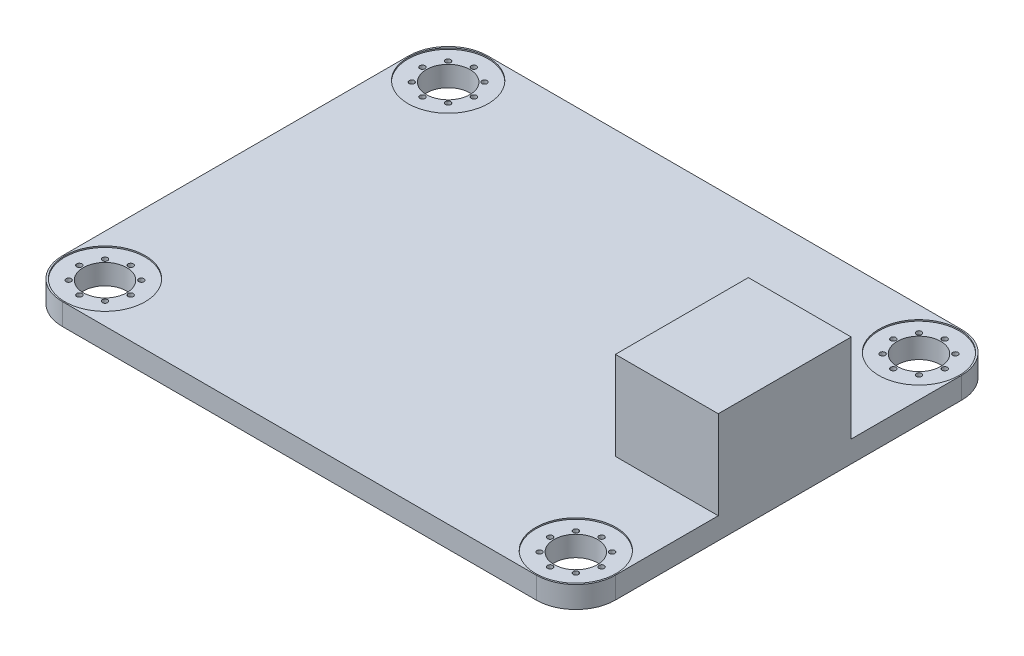
from build123d import *

# Parameters (mm, degrees)
CROQUIS1_W              = 41.94
CROQUIS1_H              = 32.26
CROQUIS1_R              = 1.65
CROQUIS1_R_2            = 0.2
SALIENTE_EXTRUIR1_DEPTH = 1.64
CORTAR_EXTRUIR1_START   = -0.1
CROQUIS2_R              = 3.04
CROQUIS2_R_2            = 1.65
CORTAR_EXTRUIR1_DEPTH   = 0.1
REDONDEO2_R             = 3
CROQUIS3_W              = 7.8
CROQUIS3_H              = 10.08
SALIENTE_EXTRUIR2_DEPTH = 6.7


with BuildPart() as part:
    # Croquis1 → Saliente-Extruir1 (new body)
    with BuildSketch(Plane(origin=(0, 0, 0), x_dir=(1, 0, 0), z_dir=(0, 1, 0))):
        Rectangle(CROQUIS1_W, CROQUIS1_H)
        with Locations(Location((-17.85, 13.01, 0), (0, 0, 270))):
            Circle(CROQUIS1_R, mode=Mode.SUBTRACT)
        with Locations(Location((17.85, 13.01, 0), (0, 0, 90))):
            Circle(CROQUIS1_R, mode=Mode.SUBTRACT)
        with Locations(Location((17.85, -13.01, 0), (0, 0, 270))):
            Circle(CROQUIS1_R, mode=Mode.SUBTRACT)
        with Locations(Location((-17.85, -13.01, 0), (0, 0, 90))):
            Circle(CROQUIS1_R, mode=Mode.SUBTRACT)
        with Locations(Location((-15.9, 13.01, 0), (0, 0, 270))):
            Circle(CROQUIS1_R_2, mode=Mode.SUBTRACT)
        with Locations(Location((-16.471141777, 11.631141777, 0), (0, 0, 270))):
            Circle(CROQUIS1_R_2, mode=Mode.SUBTRACT)
        with Locations(Location((-17.85, 11.06, 0), (0, 0, 270))):
            Circle(CROQUIS1_R_2, mode=Mode.SUBTRACT)
        with Locations(Location((-19.228858223, 11.631141777, 0), (0, 0, 270))):
            Circle(CROQUIS1_R_2, mode=Mode.SUBTRACT)
        with Locations(Location((-19.8, 13.01, 0), (0, 0, 270))):
            Circle(CROQUIS1_R_2, mode=Mode.SUBTRACT)
        with Locations(Location((-19.228858223, 14.388858223, 0), (0, 0, 270))):
            Circle(CROQUIS1_R_2, mode=Mode.SUBTRACT)
        with Locations(Location((-17.85, 14.96, 0), (0, 0, 270))):
            Circle(CROQUIS1_R_2, mode=Mode.SUBTRACT)
        with Locations(Location((-16.471141777, 14.388858223, 0), (0, 0, 270))):
            Circle(CROQUIS1_R_2, mode=Mode.SUBTRACT)
        with Locations(Location((19.8, 13.01, 0), (0, 0, 90))):
            Circle(CROQUIS1_R_2, mode=Mode.SUBTRACT)
        with Locations(Location((19.228858223, 14.388858223, 0), (0, 0, 90))):
            Circle(CROQUIS1_R_2, mode=Mode.SUBTRACT)
        with Locations(Location((17.85, 14.96, 0), (0, 0, 90))):
            Circle(CROQUIS1_R_2, mode=Mode.SUBTRACT)
        with Locations(Location((16.471141777, 14.388858223, 0), (0, 0, 90))):
            Circle(CROQUIS1_R_2, mode=Mode.SUBTRACT)
        with Locations(Location((15.9, 13.01, 0), (0, 0, 90))):
            Circle(CROQUIS1_R_2, mode=Mode.SUBTRACT)
        with Locations(Location((16.471141777, 11.631141777, 0), (0, 0, 90))):
            Circle(CROQUIS1_R_2, mode=Mode.SUBTRACT)
        with Locations(Location((19.228858223, 11.631141777, 0), (0, 0, 90))):
            Circle(CROQUIS1_R_2, mode=Mode.SUBTRACT)
        with Locations(Location((17.85, 11.06, 0), (0, 0, 90))):
            Circle(CROQUIS1_R_2, mode=Mode.SUBTRACT)
        with Locations(Location((19.228858223, -11.631141777, 0), (0, 0, 270))):
            Circle(CROQUIS1_R_2, mode=Mode.SUBTRACT)
        with Locations(Location((19.8, -13.01, 0), (0, 0, 270))):
            Circle(CROQUIS1_R_2, mode=Mode.SUBTRACT)
        with Locations(Location((19.228858223, -14.388858223, 0), (0, 0, 270))):
            Circle(CROQUIS1_R_2, mode=Mode.SUBTRACT)
        with Locations(Location((17.85, -14.96, 0), (0, 0, 270))):
            Circle(CROQUIS1_R_2, mode=Mode.SUBTRACT)
        with Locations(Location((16.471141777, -14.388858223, 0), (0, 0, 270))):
            Circle(CROQUIS1_R_2, mode=Mode.SUBTRACT)
        with Locations(Location((15.9, -13.01, 0), (0, 0, 270))):
            Circle(CROQUIS1_R_2, mode=Mode.SUBTRACT)
        with Locations(Location((17.85, -11.06, 0), (0, 0, 270))):
            Circle(CROQUIS1_R_2, mode=Mode.SUBTRACT)
        with Locations(Location((16.471141777, -11.631141777, 0), (0, 0, 270))):
            Circle(CROQUIS1_R_2, mode=Mode.SUBTRACT)
        with Locations(Location((-19.228858223, -14.388858223, 0), (0, 0, 90))):
            Circle(CROQUIS1_R_2, mode=Mode.SUBTRACT)
        with Locations(Location((-17.85, -14.96, 0), (0, 0, 90))):
            Circle(CROQUIS1_R_2, mode=Mode.SUBTRACT)
        with Locations(Location((-16.471141777, -14.388858223, 0), (0, 0, 90))):
            Circle(CROQUIS1_R_2, mode=Mode.SUBTRACT)
        with Locations(Location((-15.9, -13.01, 0), (0, 0, 90))):
            Circle(CROQUIS1_R_2, mode=Mode.SUBTRACT)
        with Locations(Location((-19.8, -13.01, 0), (0, 0, 90))):
            Circle(CROQUIS1_R_2, mode=Mode.SUBTRACT)
        with Locations(Location((-19.228858223, -11.631141777, 0), (0, 0, 90))):
            Circle(CROQUIS1_R_2, mode=Mode.SUBTRACT)
        with Locations(Location((-17.85, -11.06, 0), (0, 0, 90))):
            Circle(CROQUIS1_R_2, mode=Mode.SUBTRACT)
        with Locations(Location((-16.471141777, -11.631141777, 0), (0, 0, 90))):
            Circle(CROQUIS1_R_2, mode=Mode.SUBTRACT)
    extrude(amount=SALIENTE_EXTRUIR1_DEPTH)

    # Croquis2 → Cortar-Extruir1 (cut)
    # profile 1 of 4: a face of its own
    with BuildSketch(Plane(origin=(0, 1.64, 0), x_dir=(1, 0, 0), z_dir=(0, 1, 0)).offset(CORTAR_EXTRUIR1_START)):
        with Locations(Location((-17.85, 13.01, 0), (0, 0, 270))):
            Circle(CROQUIS2_R)
        with Locations(Location((-17.85, 13.01, 0), (0, 0, 270))):
            Circle(CROQUIS2_R_2, mode=Mode.SUBTRACT)
    # profile 2 of 4: a face of its own
    with BuildSketch(Plane(origin=(0, 1.64, 0), x_dir=(1, 0, 0), z_dir=(0, 1, 0)).offset(CORTAR_EXTRUIR1_START)):
        with Locations(Location((17.85, 13.01, 0), (0, 0, 90))):
            Circle(CROQUIS2_R)
        with Locations(Location((17.85, 13.01, 0), (0, 0, 90))):
            Circle(CROQUIS2_R_2, mode=Mode.SUBTRACT)
    # profile 3 of 4: a face of its own
    with BuildSketch(Plane(origin=(0, 1.64, 0), x_dir=(1, 0, 0), z_dir=(0, 1, 0)).offset(CORTAR_EXTRUIR1_START)):
        with Locations(Location((17.85, -13.01, 0), (0, 0, 270))):
            Circle(CROQUIS2_R)
        with Locations(Location((17.85, -13.01, 0), (0, 0, 270))):
            Circle(CROQUIS2_R_2, mode=Mode.SUBTRACT)
    # profile 4 of 4: a face of its own
    with BuildSketch(Plane(origin=(0, 1.64, 0), x_dir=(1, 0, 0), z_dir=(0, 1, 0)).offset(CORTAR_EXTRUIR1_START)):
        with Locations(Location((-17.85, -13.01, 0), (0, 0, 90))):
            Circle(CROQUIS2_R)
        with Locations(Location((-17.85, -13.01, 0), (0, 0, 90))):
            Circle(CROQUIS2_R_2, mode=Mode.SUBTRACT)
    extrude(amount=CORTAR_EXTRUIR1_DEPTH, mode=Mode.SUBTRACT)

    # Redondeo2
    redondeo2_edges = [part.edges().sort_by_distance(p)[0] for p in [
        (20.97, 0.82, 16.13),
        (-20.97, 0.82, 16.13),
        (-20.97, 0.82, -16.13),
        (20.97, 0.82, -16.13),
    ]]
    fillet(redondeo2_edges, radius=REDONDEO2_R)

    # Croquis3 → Saliente-Extruir2 (add)
    with BuildSketch(Plane(origin=(0, 1.64, 0), x_dir=(1, 0, 0), z_dir=(0, 1, 0))):
        with Locations((17.07, -0.29)):
            Rectangle(CROQUIS3_W, CROQUIS3_H)
    extrude(amount=SALIENTE_EXTRUIR2_DEPTH)


solid = part.part
